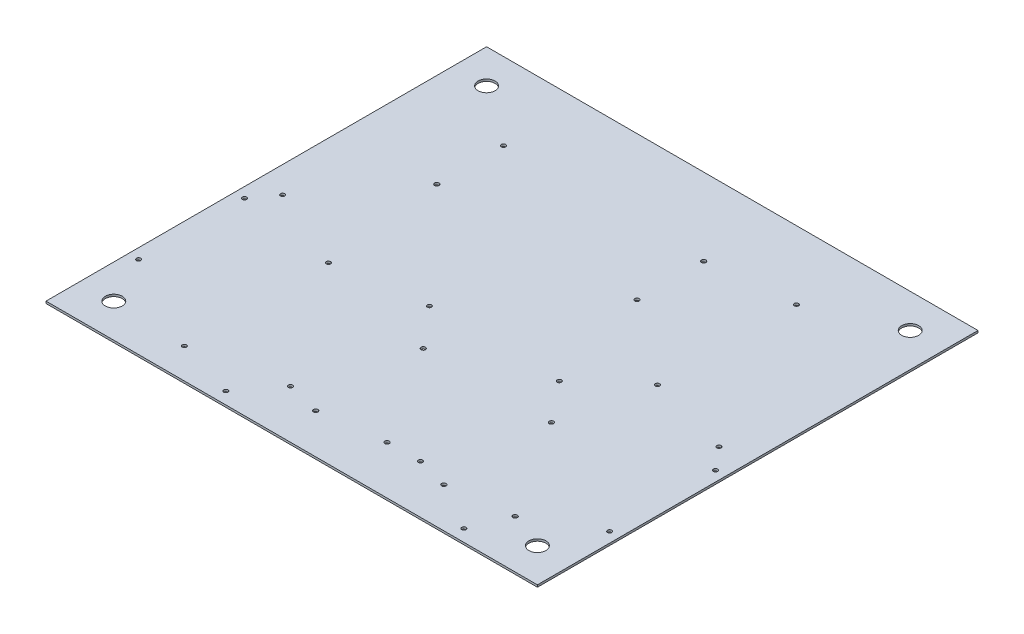
from build123d import *

# Parameters (mm, degrees)
SKETCH1_W           = 368.3
SKETCH1_H           = 330.2
BOSS_EXTRUDE1_DEPTH = 1.5875
CUT_EXTRUDE1_REACH  = 249.329
SKETCH2_R           = 6.35
CUT_EXTRUDE2_REACH  = 249.329
SKETCH3_R           = 1.665
CUT_EXTRUDE3_REACH  = 249.329
SKETCH4_R           = 1.665
SKETCH5_R           = 1.5875
CUT_EXTRUDE4_DEPTH  = 2.54


with BuildPart() as part:
    # Sketch1 → Boss-Extrude1 (new body)
    with BuildSketch(Plane(origin=(0, 0, 0), x_dir=(1, 0, 0), z_dir=(0, 1, 0))):
        Rectangle(SKETCH1_W, SKETCH1_H)
    extrude(amount=BOSS_EXTRUDE1_DEPTH)

    # Sketch2 → Cut-Extrude1 (cut, up to next)
    with BuildSketch(Plane(origin=(0, 1.5875, 0), x_dir=(1, 0, 0), z_dir=(0, 1, 0)), mode=Mode.PRIVATE) as cut_extrude1_sk1:
        with Locations(Location((-158.75, -139.7, 0), (0, 0, 270))):
            Circle(SKETCH2_R)
    cut_extrude1_tool1 = extrude(cut_extrude1_sk1.sketch, amount=-CUT_EXTRUDE1_REACH, mode=Mode.PRIVATE) & part.part
    # Sketch2 → Cut-Extrude1 (cut, up to next)
    with BuildSketch(Plane(origin=(0, 1.5875, 0), x_dir=(1, 0, 0), z_dir=(0, 1, 0)), mode=Mode.PRIVATE) as cut_extrude1_sk2:
        with Locations(Location((158.75, -139.7, 0), (0, 0, 270))):
            Circle(SKETCH2_R)
    cut_extrude1_tool2 = extrude(cut_extrude1_sk2.sketch, amount=-CUT_EXTRUDE1_REACH, mode=Mode.PRIVATE) & part.part
    # Sketch2 → Cut-Extrude1 (cut, up to next)
    with BuildSketch(Plane(origin=(0, 1.5875, 0), x_dir=(1, 0, 0), z_dir=(0, 1, 0)), mode=Mode.PRIVATE) as cut_extrude1_sk3:
        with Locations(Location((-158.75, 139.7, 0), (0, 0, 270))):
            Circle(SKETCH2_R)
    cut_extrude1_tool3 = extrude(cut_extrude1_sk3.sketch, amount=-CUT_EXTRUDE1_REACH, mode=Mode.PRIVATE) & part.part
    # Sketch2 → Cut-Extrude1 (cut, up to next)
    with BuildSketch(Plane(origin=(0, 1.5875, 0), x_dir=(1, 0, 0), z_dir=(0, 1, 0)), mode=Mode.PRIVATE) as cut_extrude1_sk4:
        with Locations(Location((158.75, 139.7, 0), (0, 0, 270))):
            Circle(SKETCH2_R)
    cut_extrude1_tool4 = extrude(cut_extrude1_sk4.sketch, amount=-CUT_EXTRUDE1_REACH, mode=Mode.PRIVATE) & part.part
    add(cut_extrude1_tool1.solids().sort_by_distance((-158.75, 1.5875, 139.7))[0], mode=Mode.SUBTRACT)
    add(cut_extrude1_tool2.solids().sort_by_distance((158.75, 1.5875, 139.7))[0], mode=Mode.SUBTRACT)
    add(cut_extrude1_tool3.solids().sort_by_distance((-158.75, 1.5875, -139.7))[0], mode=Mode.SUBTRACT)
    add(cut_extrude1_tool4.solids().sort_by_distance((158.75, 1.5875, -139.7))[0], mode=Mode.SUBTRACT)

    # Sketch3 → Cut-Extrude2 (cut, up to next)
    with BuildSketch(Plane.XZ, mode=Mode.PRIVATE) as cut_extrude2_sk1:
        with Locations(Location((-11.909873993, 135.184369153, 0), (0, 0, 270))):
            Circle(SKETCH3_R)
    cut_extrude2_tool1 = extrude(cut_extrude2_sk1.sketch, amount=-CUT_EXTRUDE2_REACH, mode=Mode.PRIVATE) & part.part
    # Sketch3 → Cut-Extrude2 (cut, up to next)
    with BuildSketch(Plane.XZ, mode=Mode.PRIVATE) as cut_extrude2_sk2:
        with Locations(Location((35.343407305, 128.976258797, 0), (0, 0, 270))):
            Circle(SKETCH3_R)
    cut_extrude2_tool2 = extrude(cut_extrude2_sk2.sketch, amount=-CUT_EXTRUDE2_REACH, mode=Mode.PRIVATE) & part.part
    # Sketch3 → Cut-Extrude2 (cut, up to next)
    with BuildSketch(Plane.XZ, mode=Mode.PRIVATE) as cut_extrude2_sk3:
        with Locations(Location((-12.037588789, 54.464245503, 0), (0, 0, 270))):
            Circle(SKETCH3_R)
    cut_extrude2_tool3 = extrude(cut_extrude2_sk3.sketch, amount=-CUT_EXTRUDE2_REACH, mode=Mode.PRIVATE) & part.part
    # Sketch3 → Cut-Extrude2 (cut, up to next)
    with BuildSketch(Plane.XZ, mode=Mode.PRIVATE) as cut_extrude2_sk4:
        with Locations(Location((84.120821947, 135.184369153, 0), (0, 0, 270))):
            Circle(SKETCH3_R)
    cut_extrude2_tool4 = extrude(cut_extrude2_sk4.sketch, amount=-CUT_EXTRUDE2_REACH, mode=Mode.PRIVATE) & part.part
    # Sketch3 → Cut-Extrude2 (cut, up to next)
    with BuildSketch(Plane.XZ, mode=Mode.PRIVATE) as cut_extrude2_sk5:
        with Locations(Location((131.374103245, 128.976258797, 0), (0, 0, 270))):
            Circle(SKETCH3_R)
    cut_extrude2_tool5 = extrude(cut_extrude2_sk5.sketch, amount=-CUT_EXTRUDE2_REACH, mode=Mode.PRIVATE) & part.part
    # Sketch3 → Cut-Extrude2 (cut, up to next)
    with BuildSketch(Plane.XZ, mode=Mode.PRIVATE) as cut_extrude2_sk6:
        with Locations(Location((83.993107151, 54.464245503, 0), (0, 0, 270))):
            Circle(SKETCH3_R)
    cut_extrude2_tool6 = extrude(cut_extrude2_sk6.sketch, amount=-CUT_EXTRUDE2_REACH, mode=Mode.PRIVATE) & part.part
    add(cut_extrude2_tool1.solids().sort_by_distance((-11.909874, 0, 135.184369))[0], mode=Mode.SUBTRACT)
    add(cut_extrude2_tool2.solids().sort_by_distance((35.343407, 0, 128.976259))[0], mode=Mode.SUBTRACT)
    add(cut_extrude2_tool3.solids().sort_by_distance((-12.037589, 0, 54.464246))[0], mode=Mode.SUBTRACT)
    add(cut_extrude2_tool4.solids().sort_by_distance((84.120822, 0, 135.184369))[0], mode=Mode.SUBTRACT)
    add(cut_extrude2_tool5.solids().sort_by_distance((131.374103, 0, 128.976259))[0], mode=Mode.SUBTRACT)
    add(cut_extrude2_tool6.solids().sort_by_distance((83.993107, 0, 54.464246))[0], mode=Mode.SUBTRACT)

    # Sketch4 → Cut-Extrude3 (cut, up to next)
    with BuildSketch(Plane(origin=(0, 1.5875, 0), x_dir=(1, 0, 0), z_dir=(0, 1, 0)), mode=Mode.PRIVATE) as cut_extrude3_sk1:
        with Locations(Location((-113.55, 57.2, 0), (0, 0, 270))):
            Circle(SKETCH4_R)
    cut_extrude3_tool1 = extrude(cut_extrude3_sk1.sketch, amount=-CUT_EXTRUDE3_REACH, mode=Mode.PRIVATE) & part.part
    # Sketch4 → Cut-Extrude3 (cut, up to next)
    with BuildSketch(Plane(origin=(0, 1.5875, 0), x_dir=(1, 0, 0), z_dir=(0, 1, 0)), mode=Mode.PRIVATE) as cut_extrude3_sk2:
        with Locations(Location((-113.55, 107.2, 0), (0, 0, 270))):
            Circle(SKETCH4_R)
    cut_extrude3_tool2 = extrude(cut_extrude3_sk2.sketch, amount=-CUT_EXTRUDE3_REACH, mode=Mode.PRIVATE) & part.part
    # Sketch4 → Cut-Extrude3 (cut, up to next)
    with BuildSketch(Plane(origin=(0, 1.5875, 0), x_dir=(1, 0, 0), z_dir=(0, 1, 0)), mode=Mode.PRIVATE) as cut_extrude3_sk3:
        with Locations(Location((36.45, 107.2, 0), (0, 0, 270))):
            Circle(SKETCH4_R)
    cut_extrude3_tool3 = extrude(cut_extrude3_sk3.sketch, amount=-CUT_EXTRUDE3_REACH, mode=Mode.PRIVATE) & part.part
    # Sketch4 → Cut-Extrude3 (cut, up to next)
    with BuildSketch(Plane(origin=(0, 1.5875, 0), x_dir=(1, 0, 0), z_dir=(0, 1, 0)), mode=Mode.PRIVATE) as cut_extrude3_sk4:
        with Locations(Location((36.45, 57.2, 0), (0, 0, 270))):
            Circle(SKETCH4_R)
    cut_extrude3_tool4 = extrude(cut_extrude3_sk4.sketch, amount=-CUT_EXTRUDE3_REACH, mode=Mode.PRIVATE) & part.part
    add(cut_extrude3_tool1.solids().sort_by_distance((-113.55, 1.5875, -57.2))[0], mode=Mode.SUBTRACT)
    add(cut_extrude3_tool2.solids().sort_by_distance((-113.55, 1.5875, -107.2))[0], mode=Mode.SUBTRACT)
    add(cut_extrude3_tool3.solids().sort_by_distance((36.45, 1.5875, -107.2))[0], mode=Mode.SUBTRACT)
    add(cut_extrude3_tool4.solids().sort_by_distance((36.45, 1.5875, -57.2))[0], mode=Mode.SUBTRACT)

    # Sketch5 → Cut-Extrude4 (cut)
    with BuildSketch(Plane(origin=(0, 1.5875, 0), x_dir=(1, 0, 0), z_dir=(0, 1, 0))):
        with Locations(Location((-103.15, -142.4, 0), (0, 0, 270))):
            Circle(SKETCH5_R)
        with Locations(Location((-103.15, -34.4, 0), (0, 0, 270))):
            Circle(SKETCH5_R)
        with Locations(Location((-176.53, -103.365, 0), (0, 0, 270))):
            Circle(SKETCH5_R)
        with Locations(Location((-176.53, -23.99, 0), (0, 0, 270))):
            Circle(SKETCH5_R)
        with Locations(Location((-164.465, -7.48, 0), (0, 0, 270))):
            Circle(SKETCH5_R)
        with Locations(Location((162.56, -7.48, 0), (0, 0, 270))):
            Circle(SKETCH5_R)
        with Locations(Location((99.37239577, 9.665, 0), (0, 0, 270))):
            Circle(SKETCH5_R)
        with Locations(Location((99.37239577, 113.805, 0), (0, 0, 270))):
            Circle(SKETCH5_R)
        with Locations(Location((176.53, -103.365, 0), (0, 0, 270))):
            Circle(SKETCH5_R)
        with Locations(Location((176.53, -23.99, 0), (0, 0, 270))):
            Circle(SKETCH5_R)
        with Locations(Location((120.02, -156.07, 0), (0, 0, 270))):
            Circle(SKETCH5_R)
        with Locations(Location((-58.415, -156.07, 0), (0, 0, 270))):
            Circle(SKETCH5_R)
        with Locations(Location((-37.233747973, -128.765, 0), (0, 0, 270))):
            Circle(SKETCH5_R)
        with Locations(Location((-37.233747973, -24.625, 0), (0, 0, 270))):
            Circle(SKETCH5_R)
        with Locations(Location((60.124549509, -128.765, 0), (0, 0, 270))):
            Circle(SKETCH5_R)
        with Locations(Location((60.124549509, -24.625, 0), (0, 0, 270))):
            Circle(SKETCH5_R)
    extrude(amount=-CUT_EXTRUDE4_DEPTH, mode=Mode.SUBTRACT)


solid = part.part
